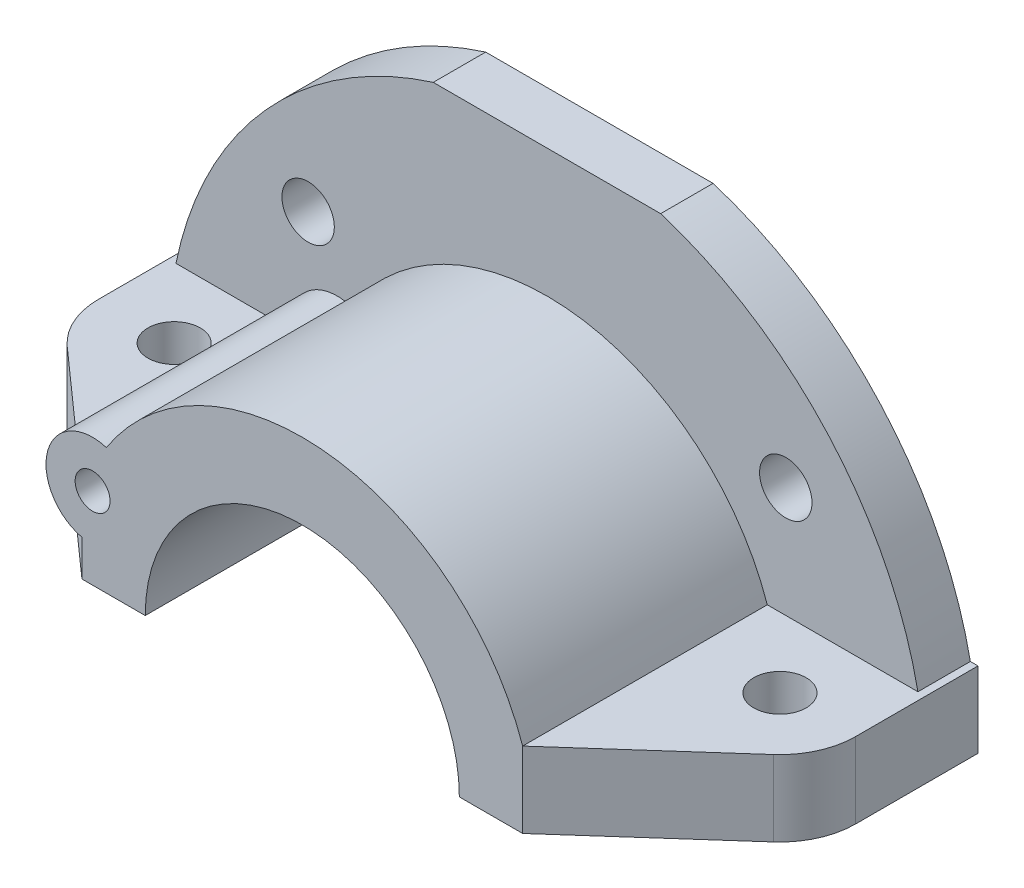
from build123d import *

# Parameters (mm, degrees)
SKETCH1_R           = 4.5
BOSS_EXTRUDE1_DEPTH = 9
BOSS_EXTRUDE2_DEPTH = 51
SKETCH2_R           = 4.5
CUT_EXTRUDE1_DEPTH  = 51
SKETCH3_R           = 8
BOSS_EXTRUDE4_DEPTH = 51
SKETCH3_3_R         = 3
CUT_EXTRUDE2_DEPTH  = 13


with BuildPart() as part:
    # Sketch1 → Boss-Extrude1 (new body)
    with BuildSketch(Plane.XY):
        with BuildLine():
            Line((-63.686733312, 13), (-37.828560639, 13))
            ThreePointArc((-37.828560639, 13), (-35.993988141, 17.448003259), (-33.638618871, 21.643551476))
            ThreePointArc((-33.638618871, 21.643551476), (4.802775087, 39.710620135), (37.828560639, 13))
            Line((37.828560639, 13), (63.686733312, 13))
            ThreePointArc((63.686733312, 13), (48.281028578, 43.519447141), (19.519221296, 62))
            Line((19.519221296, 62), (-19.519221296, 62))
            ThreePointArc((-19.519221296, 62), (-48.281028578, 43.519447141), (-63.686733312, 13))
        make_face()
        with Locations((-41, 32)):
            Circle(SKETCH1_R, mode=Mode.SUBTRACT)
        with Locations((41, 32)):
            Circle(SKETCH1_R, mode=Mode.SUBTRACT)
    extrude(amount=BOSS_EXTRUDE1_DEPTH)

    # Sketch1<3> → Boss-Extrude2 (add)
    with BuildSketch(Plane.XY):
        with BuildLine():
            Line((-65, 13), (-65, 0))
            Line((-65, 0), (-26.9625, 0))
            ThreePointArc((-26.9625, 0), (0, 26.9625), (26.9625, 0))
            Line((26.9625, 0), (65, 0))
            Line((65, 0), (65, 13))
            Line((65, 13), (37.828560639, 13))
            ThreePointArc((37.828560639, 13), (0, 40), (-37.828560639, 13))
            Line((-37.828560639, 13), (-65, 13))
        make_face()
    extrude(amount=BOSS_EXTRUDE2_DEPTH)

    # Sketch2 → Cut-Extrude1 (cut)
    with BuildSketch(Plane(origin=(0, 13, 0), x_dir=(1, 0, 0), z_dir=(0, 1, 0))):
        with BuildLine():
            Line((60.639049437, -30.714258841), (37.828560639, -51))
            Line((37.828560639, -51), (65, -51))
            Line((65, -51), (65, -21))
            ThreePointArc((65, -21), (63.859756378, -26.324112946), (60.639049437, -30.714258841))
        make_face()
        with BuildLine():
            Line((-65, -51), (-37.828560639, -51))
            Line((-37.828560639, -51), (-60.639049437, -30.714258841))
            ThreePointArc((-60.639049437, -30.714258841), (-63.859756378, -26.324112946), (-65, -21))
            Line((-65, -21), (-65, -51))
        make_face()
        with Locations((52, -21)):
            Circle(SKETCH2_R)
        with Locations((-52, -21)):
            Circle(SKETCH2_R)
    extrude(amount=-CUT_EXTRUDE1_DEPTH, mode=Mode.SUBTRACT)

    # Sketch3 → Boss-Extrude4 (add)
    with BuildSketch(Plane.XY.offset(51)):
        with Locations((-36, 14)):
            Circle(SKETCH3_R)
    extrude(amount=-BOSS_EXTRUDE4_DEPTH)

    # Sketch3<3> → Cut-Extrude2 (cut)
    with BuildSketch(Plane.XY.offset(51)):
        with Locations((-36, 14)):
            Circle(SKETCH3_3_R)
    extrude(amount=-CUT_EXTRUDE2_DEPTH, mode=Mode.SUBTRACT)


solid = part.part
